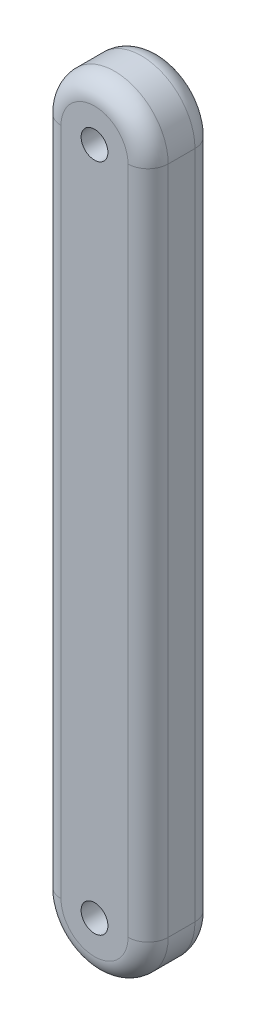
from build123d import *

# Parameters (mm, degrees)
SKETCH2_R           = 2
BOSS_EXTRUDE1_DEPTH = 10
FILLET2_R           = 3


with BuildPart() as part:
    # Sketch2 → Boss-Extrude1 (new body)
    with BuildSketch(Plane.XY):
        with BuildLine():
            Line((8, 50), (8, -50))
            ThreePointArc((8, -50), (0, -58), (-8, -50))
            Line((-8, -50), (-8, 50))
            ThreePointArc((-8, 50), (0, 58), (8, 50))
        make_face()
        with Locations((0, 50)):
            Circle(SKETCH2_R, mode=Mode.SUBTRACT)
        with Locations((0, -50)):
            Circle(SKETCH2_R, mode=Mode.SUBTRACT)
    extrude(amount=BOSS_EXTRUDE1_DEPTH)

    # Fillet2
    fillet2_edges = [part.edges().sort_by_distance(p)[0] for p in [
        (0, -58, 10),
        (8, 0, 10),
        (0, 58, 10),
        (8, 0, 0),
        (0, -58, 0),
        (-8, 0, 0),
        (0, 58, 0),
        (-8, 0, 10),
    ]]
    fillet(fillet2_edges, radius=FILLET2_R)


solid = part.part
